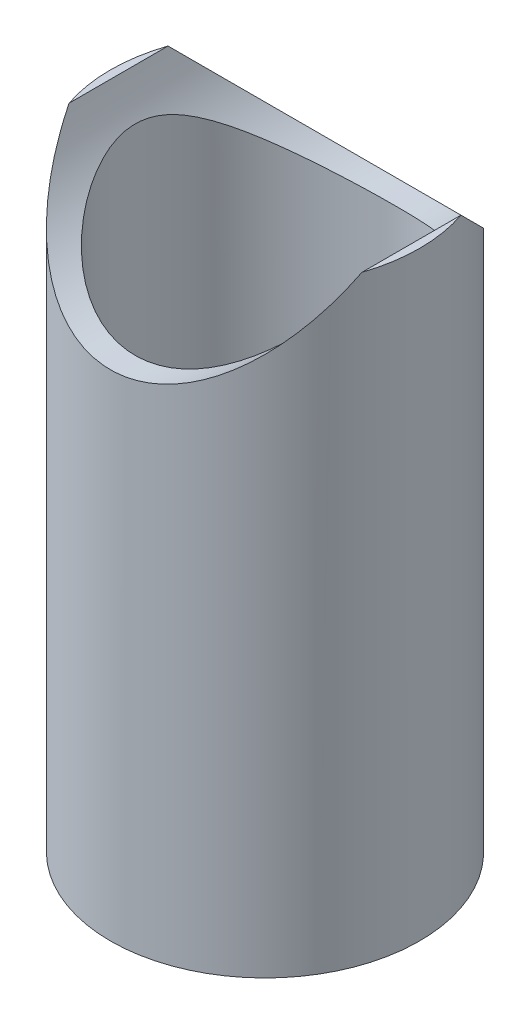
from build123d import *

# Parameters (mm, degrees)
SKETCH_1_R               = 12.5
SKETCH_1_R_2             = 10.5
EXTRUDE_1_DEPTH          = 48.5
CUT_EXTRUDE_1_DEPTH      = 52.621216568
CUT_EXTRUDE_1_DEPTH_BACK = 52.621216568
SKETCH_2_R               = 12.5
SKETCH_3_R               = 4
CUT_EXTRUDE_2_DEPTH      = 52.621216687


with BuildPart() as part:
    # Эскиз1 → Бобышка-Вытянуть1 (new body)
    with BuildSketch(Plane(origin=(0, 0, 0), x_dir=(1, 0, 0), z_dir=(0, 1, 0))):
        with Locations(Location((0, 0, 0), (0, 0, 90))):
            Circle(SKETCH_1_R)
        with Locations(Location((0, 0, 0), (0, 0, 90))):
            Circle(SKETCH_1_R_2, mode=Mode.SUBTRACT)
    extrude(amount=EXTRUDE_1_DEPTH)

    # Эскиз2 → Вырез-Вытянуть1 (cut, two sides: drawn at the far end of the back side and taken through both)
    with BuildSketch(Plane.XY.offset(-CUT_EXTRUDE_1_DEPTH_BACK)):
        with Locations((0, 52.5)):
            Circle(SKETCH_2_R)
    extrude(amount=CUT_EXTRUDE_1_DEPTH + CUT_EXTRUDE_1_DEPTH_BACK, mode=Mode.SUBTRACT)

    # Эскиз3 → Вырез-Вытянуть2 (cut, through all)
    with BuildSketch(Plane.XY):
        with Locations(Location((0, 15, 0), (0, 0, 90))):
            Circle(SKETCH_3_R)
    extrude(amount=-CUT_EXTRUDE_2_DEPTH, mode=Mode.SUBTRACT)


solid = part.part
